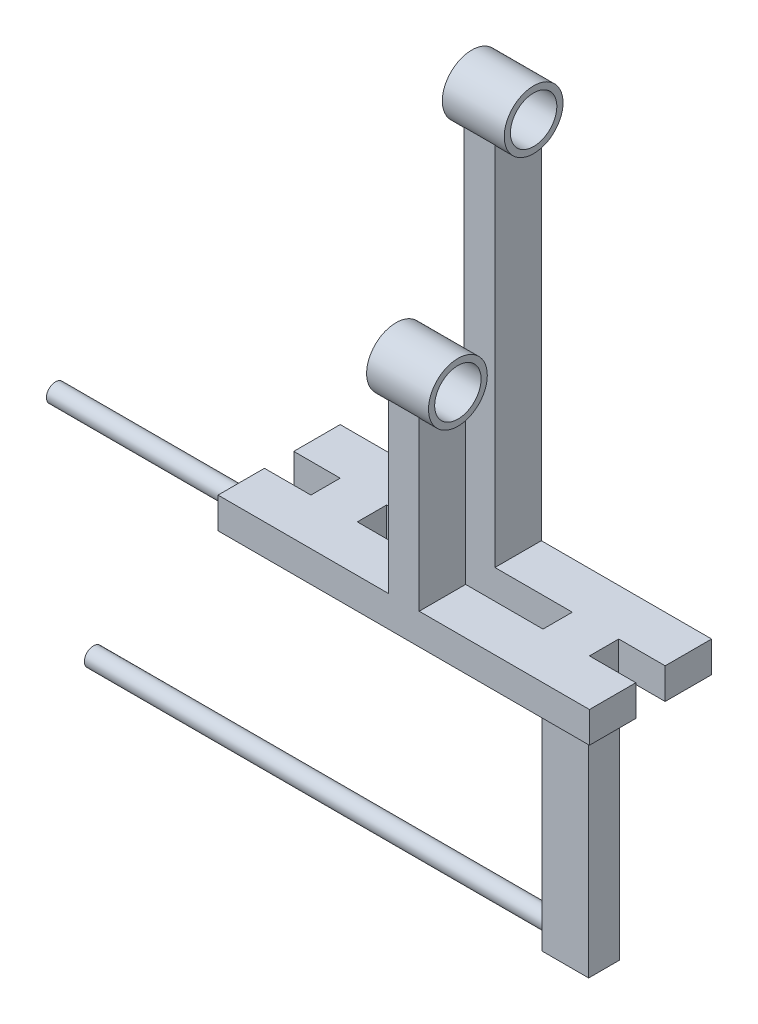
from build123d import *

# Parameters (mm, degrees)
SKETCH2_W               = 60
SKETCH2_H               = 9.4666089
BOSS_EXTRUDE2_DEPTH     = 10
SKETCH3_W               = 10
SKETCH3_H               = 15
BOSS_EXTRUDE3_DEPTH     = 60
SKETCH4_W               = 10
SKETCH4_H               = 15
BOSS_EXTRUDE4_DEPTH     = 64.0502592
SKETCH6_R               = 9.5
SKETCH6_R_2             = 7.5
EXTRUDE_THIN1_DEPTH     = 10
CUT_EXTRUDE1_DEPTH      = 160.787854054
CUT_EXTRUDE1_DEPTH_BACK = 160.787854054
SKETCH8_W               = 15
SKETCH8_H               = 10
BOSS_EXTRUDE5_DEPTH     = 80
SKETCH9_R               = 2.95
BOSS_EXTRUDE6_DEPTH     = 150
SKETCH10_R              = 2.95
BOSS_EXTRUDE7_DEPTH     = 60


with BuildPart() as part:
    # Sketch2 → Boss-Extrude2 (new body)
    with BuildSketch(Plane(origin=(0, 0, 0), x_dir=(1, 0, 0), z_dir=(0, 1, 0))):
        Polygon((60, -15), (-60, -15), (-60, 0), (-45, 0), (-45, 9.4666089), (-60, 9.4666089), (-60, 24.4666089), (60, 24.4666089), (60, 9.4666089), (45, 9.4666089), (45, 0), (60, 0), align=None)
        with Locations((0, 4.73330445)):
            Rectangle(SKETCH2_W, SKETCH2_H, mode=Mode.SUBTRACT)
    extrude(amount=BOSS_EXTRUDE2_DEPTH)

    # Sketch3 → Boss-Extrude3 (add)
    with BuildSketch(Plane(origin=(0, 10, 0), x_dir=(1, 0, 0), z_dir=(0, 1, 0))):
        with Locations((0, -7.5)):
            Rectangle(SKETCH3_W, SKETCH3_H)
        with Locations((0, 16.9666089)):
            Rectangle(SKETCH3_W, SKETCH3_H)
    extrude(amount=BOSS_EXTRUDE3_DEPTH)

    # Sketch4 → Boss-Extrude4 (add)
    with BuildSketch(Plane(origin=(0, 70, 0), x_dir=(1, 0, 0), z_dir=(0, 1, 0))):
        with Locations((0, 16.9666089)):
            Rectangle(SKETCH4_W, SKETCH4_H)
    extrude(amount=BOSS_EXTRUDE4_DEPTH)

    # Sketch6 → Extrude-Thin1 (add, symmetric)
    # profile 1 of 2: a face of its own
    with BuildSketch(Plane(origin=(0, 0, 0), x_dir=(0, 0, -1), z_dir=(1, 0, 0))):
        with Locations((-7.5, 70)):
            Circle(SKETCH6_R)
        with Locations((-7.5, 70)):
            Circle(SKETCH6_R_2, mode=Mode.SUBTRACT)
    # profile 2 of 2: a face of its own
    with BuildSketch(Plane(origin=(0, 0, 0), x_dir=(0, 0, -1), z_dir=(1, 0, 0))):
        with Locations((16.9666089, 134.0502592)):
            Circle(SKETCH6_R)
        with Locations((16.9666089, 134.0502592)):
            Circle(SKETCH6_R_2, mode=Mode.SUBTRACT)
    extrude(amount=EXTRUDE_THIN1_DEPTH, both=True)

    # Sketch7 → Cut-Extrude1 (cut, two sides: drawn at the far end of the back side and taken through both)
    with BuildSketch(Plane(origin=(5, 0, 0), x_dir=(0, 0, -1), z_dir=(1, 0, 0)).offset(-CUT_EXTRUDE1_DEPTH_BACK)):
        with BuildLine():
            Line((0, 70), (-15, 70))
            ThreePointArc((-15, 70), (-7.5, 62.5), (0, 70))
        make_face()
        with BuildLine():
            Line((24.4666089, 134.0502592), (9.4666089, 134.0502592))
            ThreePointArc((9.4666089, 134.0502592), (16.9666089, 126.5502592), (24.4666089, 134.0502592))
        make_face()
    extrude(amount=CUT_EXTRUDE1_DEPTH + CUT_EXTRUDE1_DEPTH_BACK, mode=Mode.SUBTRACT)

    # Sketch8 → Boss-Extrude5 (add)
    with BuildSketch(Plane.XZ):
        with Locations((37.5, -4.75)):
            Rectangle(SKETCH8_W, SKETCH8_H)
    extrude(amount=BOSS_EXTRUDE5_DEPTH)

    # Sketch9 → Boss-Extrude6 (add)
    with BuildSketch(Plane.ZY.offset(-30)):
        with Locations((-4.75, -75)):
            Circle(SKETCH9_R)
    extrude(amount=BOSS_EXTRUDE6_DEPTH)

    # Sketch10 → Boss-Extrude7 (add)
    with BuildSketch(Plane.ZY.offset(60)):
        with Locations(Location((7.5, 5, 0), (0, 0, 180))):
            Circle(SKETCH10_R)
    extrude(amount=BOSS_EXTRUDE7_DEPTH)


solid = part.part
